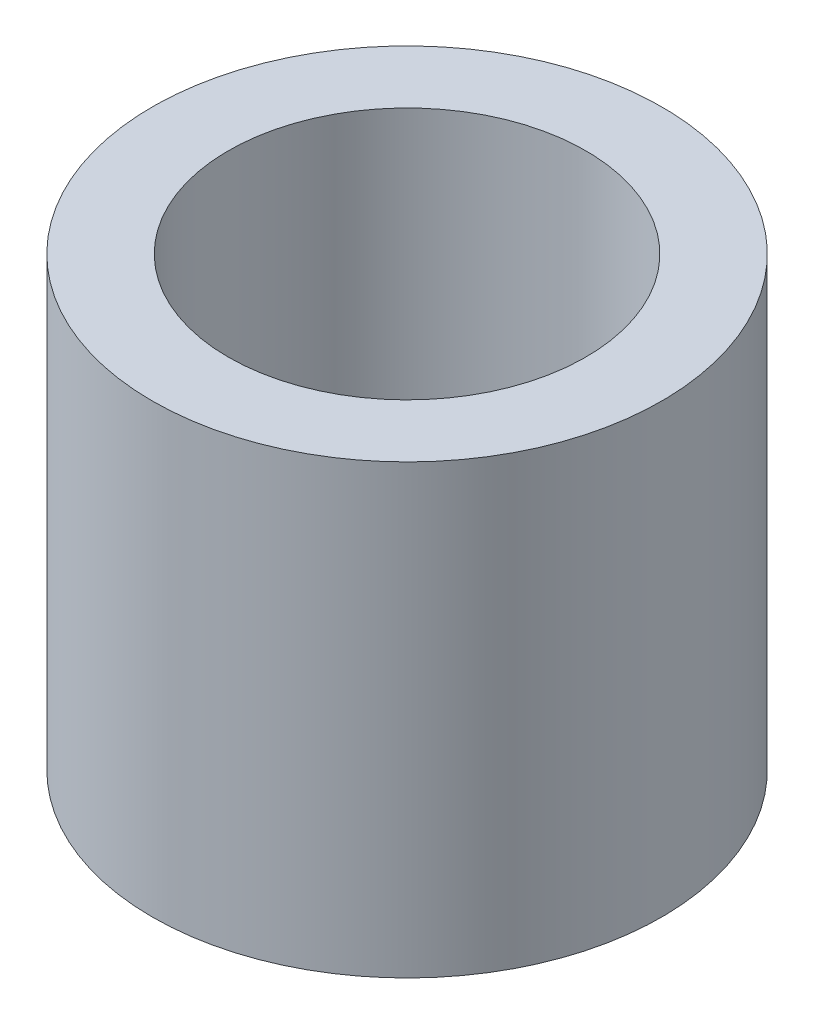
from build123d import *

# Parameters (mm, degrees)
SKETCH1_R           = 5.7
SKETCH1_R_2         = 4
BOSS_EXTRUDE1_DEPTH = 10


with BuildPart() as part:
    # Sketch1 → Boss-Extrude1 (new body)
    with BuildSketch(Plane(origin=(0, 0, 0), x_dir=(1, 0, 0), z_dir=(0, 1, 0))):
        with Locations(Location((0, 0, 0), (0, 0, 270))):
            Circle(SKETCH1_R)
        with Locations(Location((0, 0, 0), (0, 0, 270))):
            Circle(SKETCH1_R_2, mode=Mode.SUBTRACT)
    extrude(amount=BOSS_EXTRUDE1_DEPTH)


solid = part.part
